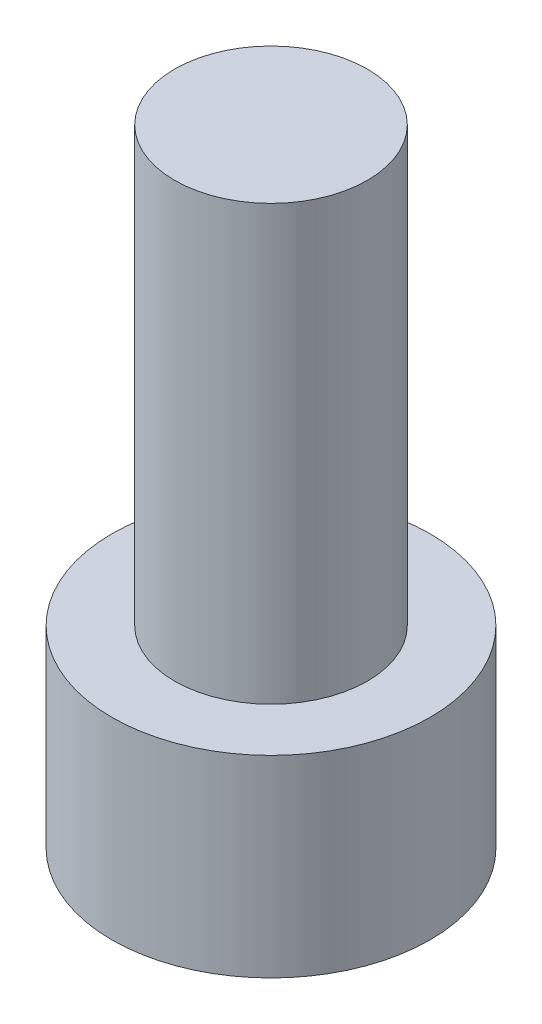
from build123d import *

# Parameters (mm, degrees)
SKETCH_1_R          = 6.6
EXTRUDE_1_DEPTH     = 8
SKETCH_2_R          = 4
EXTRUDE_2_DEPTH     = 18
CUT_EXTRUDE_1_DEPTH = 4


with BuildPart() as part:
    # 草图1 → 凸台-拉伸1 (new body)
    with BuildSketch(Plane(origin=(0, 0, 0), x_dir=(1, 0, 0), z_dir=(0, 1, 0))):
        with Locations(Location((0, 0, 0), (0, 0, 270))):
            Circle(SKETCH_1_R)
    extrude(amount=EXTRUDE_1_DEPTH)

    # 草图2 → 凸台-拉伸2 (add)
    with BuildSketch(Plane(origin=(0, 8, 0), x_dir=(1, 0, 0), z_dir=(0, 1, 0))):
        with Locations(Location((0, 0, 0), (0, 0, 270))):
            Circle(SKETCH_2_R)
    extrude(amount=EXTRUDE_2_DEPTH)

    # 草图3 → 切除-拉伸1 (cut)
    with BuildSketch(Plane.XZ):
        Polygon((3.46061635, 0.155352746), (1.59576875, 3.074658045), (-1.8648476, 2.919305299), (-3.46061635, -0.155352746), (-1.59576875, -3.074658045), (1.8648476, -2.919305299), align=None)
    extrude(amount=-CUT_EXTRUDE_1_DEPTH, mode=Mode.SUBTRACT)


solid = part.part
